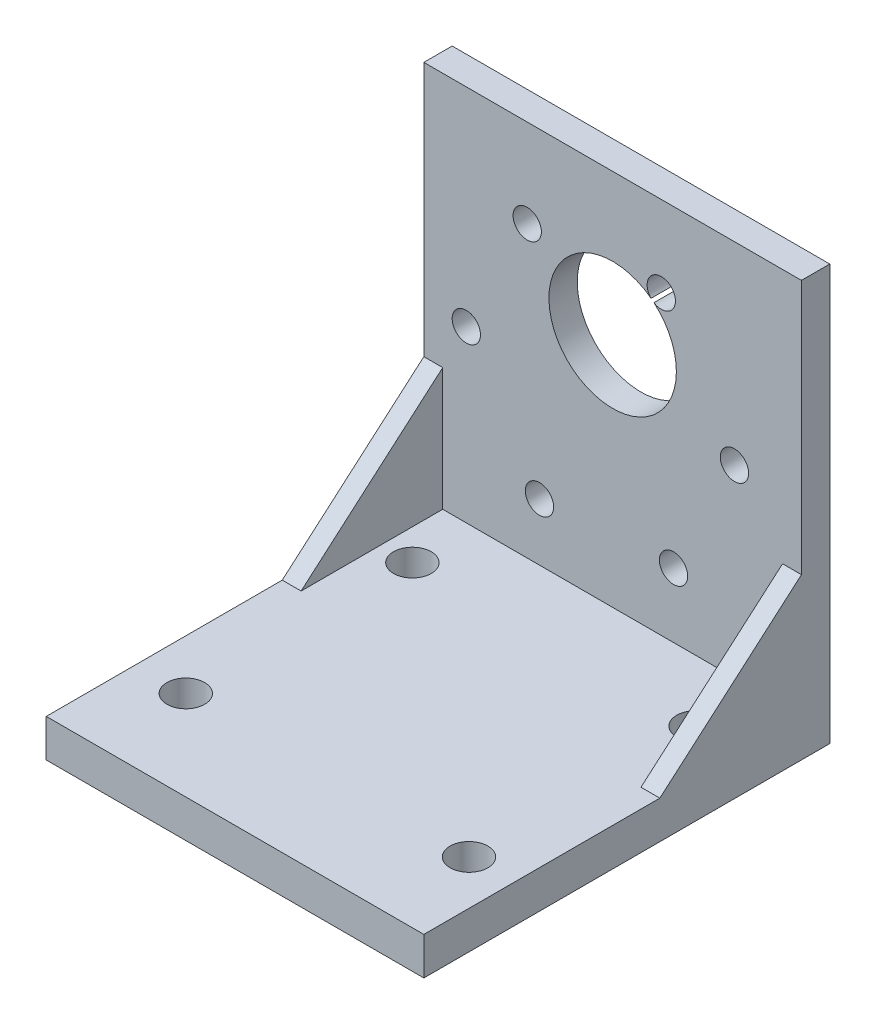
from build123d import *

# Parameters (mm, degrees)
SKETCH1_W           = 40
SKETCH1_H           = 43
SKETCH1_R           = 2
BOSS_EXTRUDE1_DEPTH = 4
SKETCH4_W           = 40
SKETCH4_H           = 3
BOSS_EXTRUDE2_DEPTH = 40
SKETCH5_R           = 6.75
CUT_EXTRUDE5_DEPTH  = 34
SKETCH8_R           = 1.5
CUT_EXTRUDE6_DEPTH  = 10
BOSS_EXTRUDE3_DEPTH = 2
BOSS_EXTRUDE4_DEPTH = 2


with BuildPart() as part:
    # Sketch1 → Boss-Extrude1 (new body)
    with BuildSketch(Plane(origin=(0, 0, 0), x_dir=(1, 0, 0), z_dir=(0, 1, 0))):
        Rectangle(SKETCH1_W, SKETCH1_H)
        with Locations(Location((-14.715053003, 12, 0), (0, 0, 270))):
            Circle(SKETCH1_R, mode=Mode.SUBTRACT)
        with Locations(Location((15.284946997, 12, 0), (0, 0, 270))):
            Circle(SKETCH1_R, mode=Mode.SUBTRACT)
        with Locations(Location((-14.715053003, -12, 0), (0, 0, 270))):
            Circle(SKETCH1_R, mode=Mode.SUBTRACT)
        with Locations(Location((15.284946997, -12, 0), (0, 0, 270))):
            Circle(SKETCH1_R, mode=Mode.SUBTRACT)
    extrude(amount=-BOSS_EXTRUDE1_DEPTH)

    # Sketch4 → Boss-Extrude2 (add)
    with BuildSketch(Plane(origin=(0, 0, 0), x_dir=(1, 0, 0), z_dir=(0, 1, 0))):
        with Locations((0, 20)):
            Rectangle(SKETCH4_W, SKETCH4_H)
    extrude(amount=BOSS_EXTRUDE2_DEPTH)

    # Sketch5 → Cut-Extrude5 (cut)
    with BuildSketch(Plane.XY.offset(-18.5)):
        with Locations((0, 25)):
            Circle(SKETCH5_R)
    extrude(amount=-CUT_EXTRUDE5_DEPTH, mode=Mode.SUBTRACT)

    # Sketch8 → Cut-Extrude6 (cut)
    with BuildSketch(Plane.XY.offset(-18.5)):
        with Locations((-15.5, 18)):
            Circle(SKETCH8_R)
        with Locations((-9.049038106, 30.673393759)):
            Circle(SKETCH8_R)
        with Locations((5.151923789, 31.423393759)):
            Circle(SKETCH8_R)
        with Locations((12.901923789, 19.5)):
            Circle(SKETCH8_R)
        with Locations((6.450961894, 6.826606241)):
            Circle(SKETCH8_R)
        with Locations((-7.75, 6.076606241)):
            Circle(SKETCH8_R)
    extrude(amount=-CUT_EXTRUDE6_DEPTH, mode=Mode.SUBTRACT)

    # Sketch9 → Boss-Extrude3 (add)
    with BuildSketch(Plane(origin=(20, 0, 0), x_dir=(0, 0, -1), z_dir=(1, 0, 0))):
        Polygon((18.5, 13), (3.5, 0), (18.5, 0), align=None)
    extrude(amount=-BOSS_EXTRUDE3_DEPTH)

    # Sketch10 → Boss-Extrude4 (add)
    with BuildSketch(Plane.ZY.offset(20)):
        Polygon((-18.5, 13), (-3.5, 0), (-18.5, 0), align=None)
    extrude(amount=-BOSS_EXTRUDE4_DEPTH)


solid = part.part
